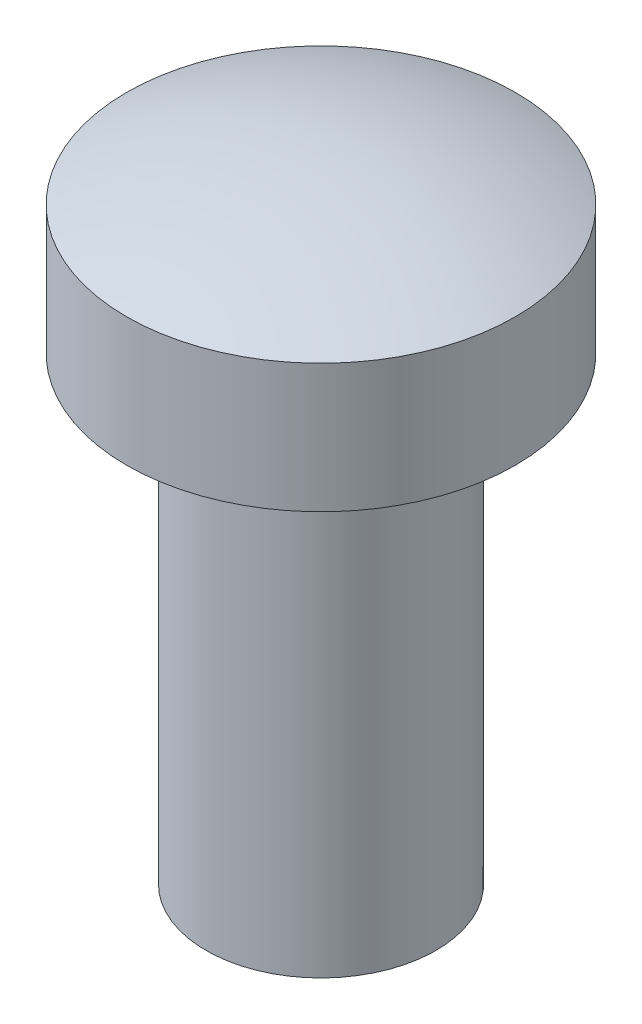
from build123d import *


with BuildPart() as part:
    # 草圖1 → 旋轉1 (revolve)
    with BuildSketch(Plane.XY, mode=Mode.PRIVATE) as revolve_1_sk:
        with BuildLine():
            Line((0, 0), (0, 2.738239362))
            ThreePointArc((0, 2.738239362), (-0.432005419, 2.693019492), (-0.845282603, 2.559320249))
            Line((-0.845282603, 2.559320249), (-0.845282603, 2))
            Line((-0.845282603, 2), (-0.5, 2))
            Line((-0.5, 2), (-0.5, 0))
            Line((-0.5, 0), (0, 0))
        make_face()
    revolve(revolve_1_sk.sketch.rotate(Axis((0, 0, 0), (0, 1, 0)), 270), axis=Axis((0, 0, 0), (0, 1, 0)))


solid = part.part
